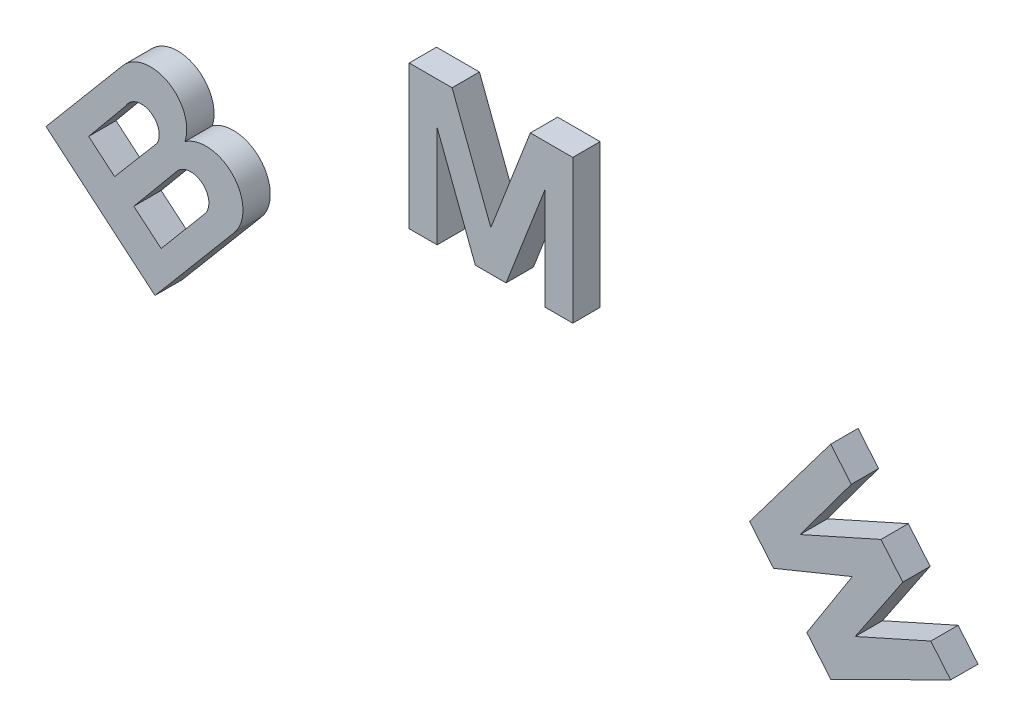
from build123d import *

# Parameters (mm, degrees)
EXTRUDE_1_DEPTH     = 2
EXTRUDE_1_2_DEPTH   = 2
EXTRUDE_1_3_DEPTH   = 2
SKETCH_6_W          = 86.886545811
SKETCH_6_H          = 45.352143988
CUT_EXTRUDE_1_DEPTH = 52.125644596


with BuildPart() as part:
    # 草图4 → 凸台-拉伸1 (new body)
    with BuildSketch(Plane.XY):
        Polygon((-32.5857633, 21.06745862), (-24.581820031, 14.318573463), (-18.667207086, 21.333098879), (-18.41413244, 21.736159792), (-18.234803522, 22.177001467), (-18.13465246, 22.642257204), (-18.116731012, 23.117843142), (-18.181557978, 23.589339724), (-18.32718786, 24.042434206), (-18.549203241, 24.463393679), (-18.840867365, 24.839477053), (-19.193337763, 25.159270754), (-19.595940912, 25.413070192), (-20.036454523, 25.593200197), (-20.501542414, 25.694198122), (-20.977090204, 25.712981691), (-21.448693598, 25.649001589), (-21.902055109, 25.504195681), (-22.323418939, 25.282943239), (-22.237939203, 25.721435061), (-22.226228083, 26.168029299), (-22.288621271, 26.610396853), (-22.423394525, 27.03633069), (-22.626817072, 27.434081545), (-22.893288935, 27.792647829), (-23.215455377, 28.102157106), (-23.584405268, 28.354064455), (-23.989976251, 28.541396608), (-24.420968378, 28.659011354), (-24.865479792, 28.703643312), (-25.311242426, 28.67405652), (-25.745965326, 28.571090212), (-26.157632196, 28.397567263), (-26.534890497, 28.158278933), (-26.867333734, 27.859832277), align=None)
        Polygon((-29.433129633, 22.00672864), (-27.536842846, 20.401686478), (-24.415383661, 24.089553347), (-24.332948053, 24.288070192), (-24.284310663, 24.497451296), (-24.270799005, 24.71198987), (-24.292779291, 24.925811281), (-24.349656427, 25.133101931), (-24.439881647, 25.328216066), (-24.560983026, 25.505813112), (-24.709672296, 25.661040773), (-24.88187536, 25.789687624), (-25.07290777, 25.888244143), (-25.277558649, 25.953994265), (-25.490235651, 25.985183229), (-25.705155695, 25.980926027), (-25.916436518, 25.941359987), (-26.118325556, 25.867568483), (-26.305306757, 25.761535158), (-26.472298944, 25.626189699), (-26.614724481, 25.465194216), (-26.728715265, 25.282943239), align=None, mode=Mode.SUBTRACT)
        Polygon((-22.927964533, 23.086165895), (-26.131158197, 19.230041018), (-24.13251623, 17.548820009), (-20.844605768, 21.457534304), (-20.737939203, 21.661635866), (-20.668130243, 21.881103029), (-20.637284601, 22.109313479), (-20.646325434, 22.339431276), (-20.694978083, 22.564528933), (-20.781777704, 22.777846804), (-20.904122675, 22.972960939), (-21.058335626, 23.143996706), (-21.239770258, 23.285842409), (-21.442979181, 23.39419507), (-21.661851251, 23.465835085), (-21.889809931, 23.498580446), (-22.119996393, 23.491454592), (-22.345490778, 23.444686403), (-22.559518183, 23.359664431), (-22.755639398, 23.23895215), align=None, mode=Mode.SUBTRACT)
    extrude(amount=EXTRUDE_1_DEPTH)


with BuildPart() as body_2:
    # 草图4 → Extrude 1 2 (new body)
    with BuildSketch(Plane.XY):
        Polygon((-5.996850336, 38.408904543), (-5.996850336, 27.859832277), (-3.91276153, 27.859832277), (-3.91276153, 35.218716958), (-1.150554499, 27.972180703), (1.12643067, 27.972180703), (3.939782293, 35.218721034), (3.939782293, 27.859832277), (6.014273321, 27.859832277), (6.014273321, 38.408905525), (2.876387274, 38.408905525), (0, 31), (-2.824097956, 38.408904543), align=None)
    extrude(amount=EXTRUDE_1_2_DEPTH)


with BuildPart() as body_3:
    # 草图4 → Extrude 1 3 (new body)
    with BuildSketch(Plane.XY):
        Polygon((24.872824347, 29.687392702), (26.402881435, 27.859829995), (22.690074891, 22.851733117), (28.558242873, 25.479165769), (30.175307816, 23.547677324), (26.718580446, 18.404779635), (32.2027141, 20.860263506), (33.683638635, 19.091386728), (24.872830811, 14.723630109), (23.099783575, 16.841430178), (26.402884161, 22.00672864), (20.684073126, 19.667968264), (18.909277594, 21.787856569), align=None)
    extrude(amount=EXTRUDE_1_3_DEPTH)


with BuildPart() as cut_extrude_1_tool:
    # 草图6 → 切除-拉伸1 (new, through all)
    with BuildSketch(Plane.XY):
        with Locations((-4.093328752, 26.77922536)):
            Rectangle(SKETCH_6_W, SKETCH_6_H)
        with BuildLine():
            ThreePointArc((-18.779945256, 21.23042121), (-18.844501198, 24.794684989), (-22.385636588, 25.205177258))
            ThreePointArc((-22.385636588, 25.205177258), (-23.622330361, 28.348625158), (-26.944490905, 27.737130673))
            Line((-26.944490905, 27.737130673), (-32.557592495, 21.069866008))
            Line((-32.557592495, 21.069866008), (-24.584217581, 14.346755935))
            Line((-24.584217581, 14.346755935), (-18.779945256, 21.23042121))
        make_face(mode=Mode.SUBTRACT)
        Polygon((26.377427175, 27.859077936), (24.873633648, 29.655270373), (18.934822664, 21.788500161), (20.690027859, 19.692011354), (26.453742022, 22.049135277), (23.124538426, 16.84301764), (24.878056962, 14.748543447), (33.65199784, 19.098024119), (32.197085963, 20.835830316), (26.663039037, 18.357998115), (30.150325546, 23.546361502), (28.552614736, 25.454732579), (22.628490187, 22.802245752), align=None, mode=Mode.SUBTRACT)
        Polygon((-3.93276153, 35.327337842), (-3.93276153, 27.879832277), (-5.976850336, 27.879832277), (-5.976850336, 38.388904543), (-2.837878126, 38.388904543), (-0.000171222, 30.944297486), (2.890076973, 38.388905525), (5.994273321, 38.388905525), (5.994273321, 27.879832277), (3.959782293, 27.879832277), (3.959782293, 35.325497874), (1.112740971, 27.992180703), (-1.136774328, 27.992180703), align=None, mode=Mode.SUBTRACT)
    extrude(amount=CUT_EXTRUDE_1_DEPTH)


with BuildPart() as part_1:
    add(part.part)

    # 切除-拉伸1: cut by cut_extrude_1_tool
    add(cut_extrude_1_tool.part, mode=Mode.SUBTRACT)


with BuildPart() as body_2_1:
    add(body_2.part)

    # 切除-拉伸1: cut by cut_extrude_1_tool
    add(cut_extrude_1_tool.part, mode=Mode.SUBTRACT)


with BuildPart() as body_3_1:
    add(body_3.part)

    # 切除-拉伸1: cut by cut_extrude_1_tool
    add(cut_extrude_1_tool.part, mode=Mode.SUBTRACT)


solid = Compound([part_1.part, body_2_1.part, body_3_1.part])
